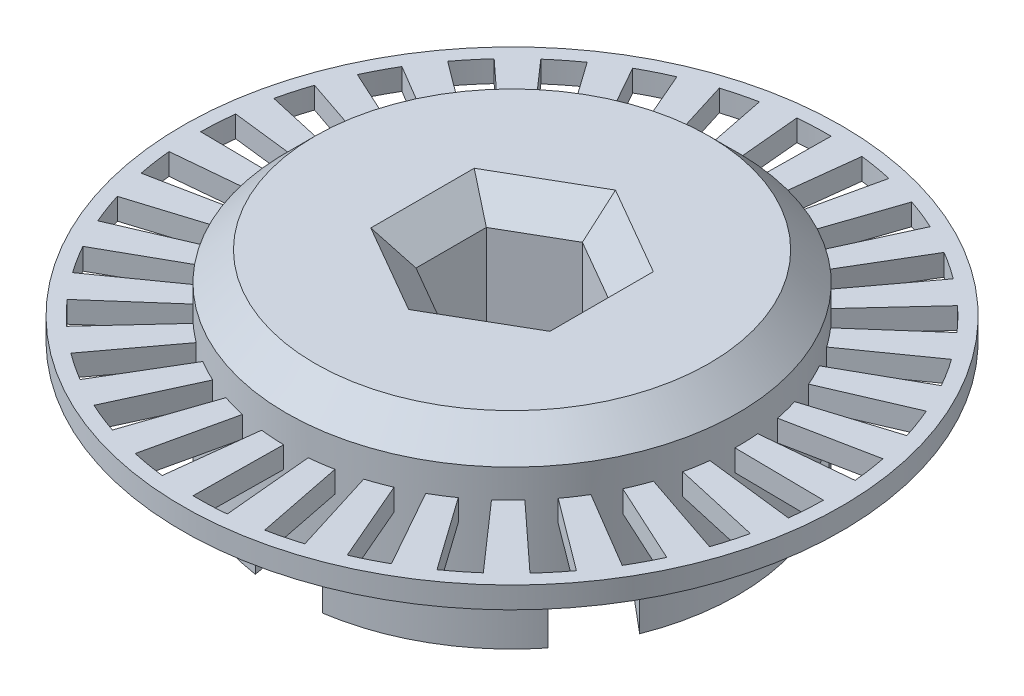
from build123d import *
from build123d.topology import SkipClean

# Parameters (mm, degrees)
SKETCH1_R           = 15.75
BOSS_EXTRUDE1_DEPTH = 10
CUT_EXTRUDE1_DEPTH  = 10
BOSS_EXTRUDE2_START = 3
BOSS_EXTRUDE2_DEPTH = 3
CHAMFER1_SIZE       = 2
BOSS_EXTRUDE3_START = 1.5
SKETCH5_R           = 23
SKETCH5_R_2         = 13.75
BOSS_EXTRUDE3_DEPTH = 1.5


with BuildPart() as part:
    # Sketch1 → Boss-Extrude1 (new body)
    with BuildSketch(Plane(origin=(0, 0, 0), x_dir=(1, 0, 0), z_dir=(0, 1, 0))):
        with Locations(Location((0, 0, 0), (0, 0, 270))):
            Circle(SKETCH1_R)
    extrude(amount=BOSS_EXTRUDE1_DEPTH)

    # Sketch2 → Cut-Extrude1 (cut)
    with BuildSketch(Plane(origin=(0, 10, 0), x_dir=(1, 0, 0), z_dir=(0, 1, 0))):
        Polygon((4.25, 2.453738644), (0, 4.907477288), (-4.25, 2.453738644), (-4.25, -2.453738644), (0, -4.907477288), (4.25, -2.453738644), align=None)
    extrude(amount=-CUT_EXTRUDE1_DEPTH, mode=Mode.SUBTRACT)

    # Sketch3 → Boss-Extrude2 (add)
    with SkipClean():  # the faces are left unmerged after this step: merging them gives an invalid solid
        with BuildSketch(Plane.XZ.offset(BOSS_EXTRUDE2_START)):
            with BuildLine():
                Line((-14.660328147, -5.756498818), (-7.8, 0))
                Line((-7.8, 0), (-14.660328147, 5.756498818))
                ThreePointArc((-14.660328147, 5.756498818), (-15.75, 0), (-14.660328147, -5.756498818))
            make_face()
            with BuildLine():
                Line((-3.9, -6.75499815), (-12.315438286, -9.817967194))
                ThreePointArc((-12.315438286, -9.817967194), (-7.875, -13.63990011), (-2.34488986, -15.574466011))
                Line((-2.34488986, -15.574466011), (-3.9, -6.75499815))
            make_face()
            with BuildLine():
                Line((3.9, -6.75499815), (2.34488986, -15.574466011))
                ThreePointArc((2.34488986, -15.574466011), (7.875, -13.63990011), (12.315438286, -9.817967194))
                Line((12.315438286, -9.817967194), (3.9, -6.75499815))
            make_face()
            with BuildLine():
                Line((7.8, 0), (14.660328147, -5.756498818))
                ThreePointArc((14.660328147, -5.756498818), (15.475184463, -2.929362703), (15.75, 0))
                ThreePointArc((15.75, 0), (15.475184463, 2.929362703), (14.660328147, 5.756498818))
                Line((14.660328147, 5.756498818), (7.8, 0))
            make_face()
            with BuildLine():
                ThreePointArc((12.315438286, 9.817967194), (7.875, 13.63990011), (2.34488986, 15.574466011))
                Line((2.34488986, 15.574466011), (3.9, 6.75499815))
                Line((3.9, 6.75499815), (12.315438286, 9.817967194))
            make_face()
            with BuildLine():
                ThreePointArc((-2.34488986, 15.574466011), (-7.875, 13.63990011), (-12.315438286, 9.817967194))
                Line((-12.315438286, 9.817967194), (-3.9, 6.75499815))
                Line((-3.9, 6.75499815), (-2.34488986, 15.574466011))
            make_face()
        extrude(amount=-BOSS_EXTRUDE2_DEPTH)

    # Chamfer1
    chamfer1_edges = [part.edges().sort_by_distance(p)[0] for p in [
        (4.25, 10, 0),
        (2.125, 10, -3.680607966),
        (-2.125, 10, -3.680607966),
        (-4.25, 10, 0),
        (-2.125, 10, 3.680607966),
        (2.125, 10, 3.680607966),
        (0, 10, -15.75),
    ]]
    chamfer(chamfer1_edges, length=CHAMFER1_SIZE)

    # Sketch5 → Boss-Extrude3 (add)
    with SkipClean():  # the faces are left unmerged after this step: merging them gives an invalid solid
        with BuildSketch(Plane(origin=(0, 6, 0), x_dir=(-1, 0, 0), z_dir=(0, -1, 0)).offset(BOSS_EXTRUDE3_START)):
            with Locations(Location((0, 0, 0), (0, 0, 90))):
                Circle(SKETCH5_R)
            Circle(SKETCH5_R_2, mode=Mode.SUBTRACT)
            with BuildLine():
                Line((21.573313384, -4.311861505), (15.444531173, -3.08690085))
                ThreePointArc((15.444531173, -3.08690085), (15.584920887, -2.274366052), (15.682593417, -1.455597375))
                Line((15.682593417, -1.455597375), (21.905844773, -2.033215381))
                ThreePointArc((21.905844773, -2.033215381), (21.769413303, -3.176892263), (21.573313384, -4.311861505))
            make_face(mode=Mode.SUBTRACT)
            with BuildLine():
                Line((20.20539831, -8.702981048), (14.465228336, -6.23054325))
                ThreePointArc((14.465228336, -6.23054325), (14.771485682, -5.46495295), (15.037255413, -4.684383594))
                Line((15.037255413, -4.684383594), (21.004420259, -6.543265972))
                ThreePointArc((21.004420259, -6.543265972), (20.633186349, -7.633585073), (20.20539831, -8.702981048))
            make_face(mode=Mode.SUBTRACT)
            with BuildLine():
                Line((17.954410374, -12.713738558), (12.853725609, -9.101881013))
                ThreePointArc((12.853725609, -9.101881013), (13.312465671, -8.41669518), (13.73471719, -7.708439771))
                Line((13.73471719, -7.708439771), (19.185001789, -10.767344442))
                ThreePointArc((19.185001789, -10.767344442), (18.595190144, -11.756653585), (17.954410374, -12.713738558))
            make_face(mode=Mode.SUBTRACT)
            with BuildLine():
                Line((14.91872855, -16.168844685), (10.680453394, -11.5754229))
                ThreePointArc((10.680453394, -11.5754229), (11.27162703, -11.000587443), (11.83190592, -10.395600142))
                Line((11.83190592, -10.395600142), (16.527106682, -14.520838293))
                ThreePointArc((16.527106682, -14.520838293), (15.744494899, -15.365899921), (14.91872855, -16.168844685))
            make_face(mode=Mode.SUBTRACT)
            with BuildLine():
                Line((11.2310267, -18.917294713), (8.040394115, -13.543063261))
                ThreePointArc((8.040394115, -13.543063261), (8.7381642, -13.103701248), (9.411983585, -12.628422902))
                Line((9.411983585, -12.628422902), (13.146897706, -17.639701831))
                ThreePointArc((13.146897706, -17.639701831), (12.205689677, -18.303582696), (11.2310267, -18.917294713))
            make_face(mode=Mode.SUBTRACT)
            with BuildLine():
                Line((7.052475091, -20.838968187), (5.048931031, -14.91880677))
                ThreePointArc((5.048931031, -14.91880677), (5.822801665, -14.63412043), (6.580712404, -14.309322984))
                Line((6.580712404, -14.309322984), (9.192106215, -19.987625755))
                ThreePointArc((9.192106215, -19.987625755), (8.133437246, -20.441311077), (7.052475091, -20.838968187))
            make_face(mode=Mode.SUBTRACT)
            with BuildLine():
                Line((2.565696479, -21.849878754), (1.836805434, -15.642526835))
                ThreePointArc((1.836805434, -15.642526835), (2.652954756, -15.524958327), (3.461832513, -15.364836987))
                Line((3.461832513, -15.364836987), (4.835575574, -21.461994522))
                ThreePointArc((4.835575574, -21.461994522), (3.705714579, -21.685656076), (2.565696479, -21.849878754))
            make_face(mode=Mode.SUBTRACT)
            with BuildLine():
                Line((-2.033215381, -21.905844773), (-1.455597375, -15.682593417))
                ThreePointArc((-1.455597375, -15.682593417), (-0.632839007, -15.737281048), (0.19165393, -15.748833886))
                Line((0.19165393, -15.748833886), (0.267707076, -21.998371142))
                ThreePointArc((0.267707076, -21.998371142), (-0.883965596, -21.982233845), (-2.033215381, -21.905844773))
            make_face(mode=Mode.SUBTRACT)
            with BuildLine():
                Line((-6.543265972, -21.004420259), (-4.684383594, -15.037255413))
                ThreePointArc((-4.684383594, -15.037255413), (-3.890974668, -15.261809072), (-3.08690085, -15.444531173))
                Line((-3.08690085, -15.444531173), (-4.311861505, -21.573313384))
                ThreePointArc((-4.311861505, -21.573313384), (-5.435012234, -21.318082513), (-6.543265972, -21.004420259))
            make_face(mode=Mode.SUBTRACT)
            with BuildLine():
                Line((-10.767344442, -19.185001789), (-7.708439771, -13.73471719))
                ThreePointArc((-7.708439771, -13.73471719), (-6.979056065, -14.119322804), (-6.23054325, -14.465228336))
                Line((-6.23054325, -14.465228336), (-8.702981048, -20.20539831))
                ThreePointArc((-8.702981048, -20.20539831), (-9.748522757, -19.722228679), (-10.767344442, -19.185001789))
            make_face(mode=Mode.SUBTRACT)
            with BuildLine():
                Line((-14.520838293, -16.527106682), (-10.395600142, -11.83190592))
                ThreePointArc((-10.395600142, -11.83190592), (-9.762119222, -12.359754378), (-9.101881013, -12.853725609))
                Line((-9.101881013, -12.853725609), (-12.713738558, -17.954410374))
                ThreePointArc((-12.713738558, -17.954410374), (-13.635976057, -17.264418814), (-14.520838293, -16.527106682))
            make_face(mode=Mode.SUBTRACT)
            with BuildLine():
                Line((-17.639701831, -13.146897706), (-12.628422902, -9.411983585))
                ThreePointArc((-12.628422902, -9.411983585), (-12.118530926, -10.060005377), (-11.5754229, -10.680453394))
                Line((-11.5754229, -10.680453394), (-16.168844685, -14.91872855))
                ThreePointArc((-16.168844685, -14.91872855), (-16.92747177, -14.052071003), (-17.639701831, -13.146897706))
            make_face(mode=Mode.SUBTRACT)
            with BuildLine():
                Line((-19.987625755, -9.192106215), (-14.309322984, -6.580712404))
                ThreePointArc((-14.309322984, -6.580712404), (-13.945304678, -7.320585868), (-13.543063261, -8.040394115))
                Line((-13.543063261, -8.040394115), (-18.917294713, -11.2310267))
                ThreePointArc((-18.917294713, -11.2310267), (-19.47915574, -10.22558026), (-19.987625755, -9.192106215))
            make_face(mode=Mode.SUBTRACT)
            with BuildLine():
                Line((-21.461994522, -4.835575574), (-15.364836987, -3.461832513))
                ThreePointArc((-15.364836987, -3.461832513), (-15.162601697, -4.261221628), (-14.91880677, -5.048931031))
                Line((-14.91880677, -5.048931031), (-20.838968187, -7.052475091))
                ThreePointArc((-20.838968187, -7.052475091), (-21.179507133, -5.952182592), (-21.461994522, -4.835575574))
            make_face(mode=Mode.SUBTRACT)
            with BuildLine():
                Line((-21.998371142, -0.267707076), (-15.748833886, -0.19165393))
                ThreePointArc((-15.748833886, -0.19165393), (-15.717220265, -1.015621556), (-15.642526835, -1.836805434))
                Line((-15.642526835, -1.836805434), (-21.849878754, -2.565696479))
                ThreePointArc((-21.849878754, -2.565696479), (-21.954212434, -1.418645983), (-21.998371142, -0.267707076))
            make_face(mode=Mode.SUBTRACT)
            with BuildLine():
                Line((-21.573313384, 4.311861505), (-15.444531173, 3.08690085))
                ThreePointArc((-15.444531173, 3.08690085), (-15.584920887, 2.274366052), (-15.682593417, 1.455597375))
                Line((-15.682593417, 1.455597375), (-21.905844773, 2.033215381))
                ThreePointArc((-21.905844773, 2.033215381), (-21.769413303, 3.176892263), (-21.573313384, 4.311861505))
            make_face(mode=Mode.SUBTRACT)
            with BuildLine():
                Line((-20.20539831, 8.702981048), (-14.465228336, 6.23054325))
                ThreePointArc((-14.465228336, 6.23054325), (-14.771485682, 5.46495295), (-15.037255413, 4.684383594))
                Line((-15.037255413, 4.684383594), (-21.004420259, 6.543265972))
                ThreePointArc((-21.004420259, 6.543265972), (-20.633186349, 7.633585073), (-20.20539831, 8.702981048))
            make_face(mode=Mode.SUBTRACT)
            with BuildLine():
                Line((-17.954410374, 12.713738558), (-12.853725609, 9.101881013))
                ThreePointArc((-12.853725609, 9.101881013), (-13.312465671, 8.41669518), (-13.73471719, 7.708439771))
                Line((-13.73471719, 7.708439771), (-19.185001789, 10.767344442))
                ThreePointArc((-19.185001789, 10.767344442), (-18.595190144, 11.756653585), (-17.954410374, 12.713738558))
            make_face(mode=Mode.SUBTRACT)
            with BuildLine():
                Line((-14.91872855, 16.168844685), (-10.680453394, 11.5754229))
                ThreePointArc((-10.680453394, 11.5754229), (-11.27162703, 11.000587443), (-11.83190592, 10.395600142))
                Line((-11.83190592, 10.395600142), (-16.527106682, 14.520838293))
                ThreePointArc((-16.527106682, 14.520838293), (-15.744494899, 15.365899921), (-14.91872855, 16.168844685))
            make_face(mode=Mode.SUBTRACT)
            with BuildLine():
                Line((-11.2310267, 18.917294713), (-8.040394115, 13.543063261))
                ThreePointArc((-8.040394115, 13.543063261), (-8.7381642, 13.103701248), (-9.411983585, 12.628422902))
                Line((-9.411983585, 12.628422902), (-13.146897706, 17.639701831))
                ThreePointArc((-13.146897706, 17.639701831), (-12.205689677, 18.303582696), (-11.2310267, 18.917294713))
            make_face(mode=Mode.SUBTRACT)
            with BuildLine():
                Line((-7.052475091, 20.838968187), (-5.048931031, 14.91880677))
                ThreePointArc((-5.048931031, 14.91880677), (-5.822801665, 14.63412043), (-6.580712404, 14.309322984))
                Line((-6.580712404, 14.309322984), (-9.192106215, 19.987625755))
                ThreePointArc((-9.192106215, 19.987625755), (-8.133437246, 20.441311077), (-7.052475091, 20.838968187))
            make_face(mode=Mode.SUBTRACT)
            with BuildLine():
                Line((-2.565696479, 21.849878754), (-1.836805434, 15.642526835))
                ThreePointArc((-1.836805434, 15.642526835), (-2.652954756, 15.524958327), (-3.461832513, 15.364836987))
                Line((-3.461832513, 15.364836987), (-4.835575574, 21.461994522))
                ThreePointArc((-4.835575574, 21.461994522), (-3.705714579, 21.685656076), (-2.565696479, 21.849878754))
            make_face(mode=Mode.SUBTRACT)
            with BuildLine():
                Line((2.033215381, 21.905844773), (1.455597375, 15.682593417))
                ThreePointArc((1.455597375, 15.682593417), (0.632839007, 15.737281048), (-0.19165393, 15.748833886))
                Line((-0.19165393, 15.748833886), (-0.267707076, 21.998371142))
                ThreePointArc((-0.267707076, 21.998371142), (0.883965596, 21.982233845), (2.033215381, 21.905844773))
            make_face(mode=Mode.SUBTRACT)
            with BuildLine():
                Line((6.543265972, 21.004420259), (4.684383594, 15.037255413))
                ThreePointArc((4.684383594, 15.037255413), (3.890974668, 15.261809072), (3.08690085, 15.444531173))
                Line((3.08690085, 15.444531173), (4.311861505, 21.573313384))
                ThreePointArc((4.311861505, 21.573313384), (5.435012234, 21.318082513), (6.543265972, 21.004420259))
            make_face(mode=Mode.SUBTRACT)
            with BuildLine():
                Line((10.767344442, 19.185001789), (7.708439771, 13.73471719))
                ThreePointArc((7.708439771, 13.73471719), (6.979056065, 14.119322804), (6.23054325, 14.465228336))
                Line((6.23054325, 14.465228336), (8.702981048, 20.20539831))
                ThreePointArc((8.702981048, 20.20539831), (9.748522757, 19.722228679), (10.767344442, 19.185001789))
            make_face(mode=Mode.SUBTRACT)
            with BuildLine():
                Line((14.520838293, 16.527106682), (10.395600142, 11.83190592))
                ThreePointArc((10.395600142, 11.83190592), (9.762119222, 12.359754378), (9.101881013, 12.853725609))
                Line((9.101881013, 12.853725609), (12.713738558, 17.954410374))
                ThreePointArc((12.713738558, 17.954410374), (13.635976057, 17.264418814), (14.520838293, 16.527106682))
            make_face(mode=Mode.SUBTRACT)
            with BuildLine():
                Line((17.639701831, 13.146897706), (12.628422902, 9.411983585))
                ThreePointArc((12.628422902, 9.411983585), (12.118530926, 10.060005377), (11.5754229, 10.680453394))
                Line((11.5754229, 10.680453394), (16.168844685, 14.91872855))
                ThreePointArc((16.168844685, 14.91872855), (16.92747177, 14.052071003), (17.639701831, 13.146897706))
            make_face(mode=Mode.SUBTRACT)
            with BuildLine():
                Line((19.987625755, 9.192106215), (14.309322984, 6.580712404))
                ThreePointArc((14.309322984, 6.580712404), (13.945304678, 7.320585868), (13.543063261, 8.040394115))
                Line((13.543063261, 8.040394115), (18.917294713, 11.2310267))
                ThreePointArc((18.917294713, 11.2310267), (19.47915574, 10.22558026), (19.987625755, 9.192106215))
            make_face(mode=Mode.SUBTRACT)
            with BuildLine():
                Line((21.461994522, 4.835575574), (15.364836987, 3.461832513))
                ThreePointArc((15.364836987, 3.461832513), (15.162601697, 4.261221628), (14.91880677, 5.048931031))
                Line((14.91880677, 5.048931031), (20.838968187, 7.052475091))
                ThreePointArc((20.838968187, 7.052475091), (21.179507133, 5.952182592), (21.461994522, 4.835575574))
            make_face(mode=Mode.SUBTRACT)
            with BuildLine():
                Line((21.998371142, 0.267707076), (15.748833886, 0.19165393))
                ThreePointArc((15.748833886, 0.19165393), (15.717220265, 1.015621556), (15.642526835, 1.836805434))
                Line((15.642526835, 1.836805434), (21.849878754, 2.565696479))
                ThreePointArc((21.849878754, 2.565696479), (21.954212434, 1.418645983), (21.998371142, 0.267707076))
            make_face(mode=Mode.SUBTRACT)
        extrude(amount=-BOSS_EXTRUDE3_DEPTH)


solid = part.part
